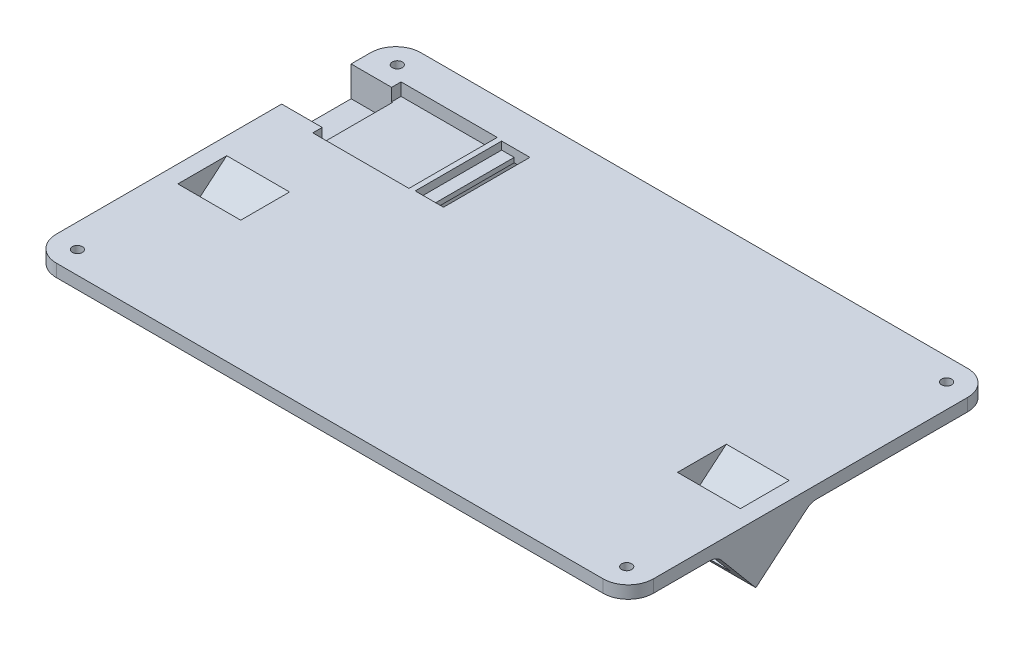
from build123d import *

# Parameters (mm, degrees)
SKETCH_1_W          = 272.533053494
SKETCH_1_H          = 136.587531522
EXTRUDE_1_DEPTH     = 4
SKETCH_2_W          = 272.533053494
SKETCH_2_H          = 136.587531522
CUT_EXTRUDE_1_DEPTH = 4
CUT_EXTRUDE_2_DEPTH = 4
CUT_EXTRUDE_3_DEPTH = 4
SKETCH_5_W          = 34
SKETCH_5_H          = 36
EXTRUDE_2_DEPTH     = 4
SKETCH_6_W          = 13.2
SKETCH_6_H          = 4
EXTRUDE_3_DEPTH     = 5.6
SKETCH_7_W          = 17.2
SKETCH_7_H          = 30.1
EXTRUDE_4_DEPTH     = 4
SKETCH_8_W          = 5
SKETCH_8_H          = 27.5
CUT_EXTRUDE_4_DEPTH = 4
SKETCH_9_W          = 27.5
SKETCH_9_H          = 2.5
CUT_EXTRUDE_5_DEPTH = 4
SKETCH_10_R         = 1.6
CUT_EXTRUDE_6_DEPTH = 10
EXTRUDE_5_DEPTH     = 190
SKETCH_13_W         = 20
SKETCH_13_H         = 10
CUT_EXTRUDE_7_DEPTH = 300
SKETCH_16_W         = 123.462838452
SKETCH_16_H         = 44.826507499
CUT_EXTRUDE_8_DEPTH = 21
FILLET_2_R          = 5


with BuildPart() as part:
    # 草图1 → 凸台-拉伸1 (new body)
    with BuildSketch(Plane(origin=(0, 0, 0), x_dir=(1, 0, 0), z_dir=(0, 1, 0))):
        Rectangle(SKETCH_1_W, SKETCH_1_H)
    extrude(amount=EXTRUDE_1_DEPTH)

    # 草图2 → 切除-拉伸1 (cut)
    with BuildSketch(Plane(origin=(0, 4, 0), x_dir=(1, 0, 0), z_dir=(0, 1, 0))):
        Rectangle(SKETCH_2_W, SKETCH_2_H)
        with BuildLine():
            Line((-87, 58), (87, 58))
            ThreePointArc((87, 58), (92.656854249, 55.656854249), (95, 50))
            Line((95, 50), (95, -50))
            ThreePointArc((95, -50), (92.656854249, -55.656854249), (87, -58))
            Line((87, -58), (-87, -58))
            ThreePointArc((-87, -58), (-92.656854249, -55.656854249), (-95, -50))
            Line((-95, -50), (-95, 50))
            ThreePointArc((-95, 50), (-92.656854249, 55.656854249), (-87, 58))
        make_face(mode=Mode.SUBTRACT)
    extrude(amount=-CUT_EXTRUDE_1_DEPTH, mode=Mode.SUBTRACT)

    # 草图3 → 切除-拉伸2 (cut)
    with BuildSketch(Plane.XZ):
        Polygon((-95, -22), (-81.8, -22), (-81.8, -19), (-51.8, -19), (-51.8, -46.5), (-81.8, -46.5), (-81.8, -43.5), (-95, -43.5), align=None)
    extrude(amount=-CUT_EXTRUDE_2_DEPTH, mode=Mode.SUBTRACT)

    # 草图4 → 切除-拉伸3 (cut)
    with BuildSketch(Plane.XZ):
        Polygon((-51.5, -18.7), (-51.5, -46.8), (-82.1, -46.8), (-82.1, -43.8), (-95, -43.8), (-95, -21.7), (-82.1, -21.7), (-82.1, -18.7), align=None)
    extrude(amount=-CUT_EXTRUDE_3_DEPTH, mode=Mode.SUBTRACT)

    # 草图5 → 凸台-拉伸2 (add)
    with BuildSketch(Plane.XZ):
        with Locations((-64.8, -32.75)):
            Rectangle(SKETCH_5_W, SKETCH_5_H)
    extrude(amount=EXTRUDE_2_DEPTH)

    # 草图6 → 凸台-拉伸3 (add)
    with BuildSketch(Plane.XZ):
        with Locations((-88.4, -19.7)):
            Rectangle(SKETCH_6_W, SKETCH_6_H)
        with Locations((-88.4, -45.8)):
            Rectangle(SKETCH_6_W, SKETCH_6_H)
    extrude(amount=EXTRUDE_3_DEPTH)

    # 草图7 → 凸台-拉伸4 (add)
    with BuildSketch(Plane.XZ.offset(5.6)):
        with Locations((-86.4, -32.75)):
            Rectangle(SKETCH_7_W, SKETCH_7_H)
    extrude(amount=EXTRUDE_4_DEPTH)

    # 草图8 → 切除-拉伸4 (cut)
    with BuildSketch(Plane(origin=(0, 4, 0), x_dir=(1, 0, 0), z_dir=(0, 1, 0))):
        with Locations((-43.3, 32.75)):
            Rectangle(SKETCH_8_W, SKETCH_8_H)
    extrude(amount=-CUT_EXTRUDE_4_DEPTH, mode=Mode.SUBTRACT)

    # 草图9 → 切除-拉伸5 (cut)
    with BuildSketch(Plane(origin=(-45.8, 0, 0), x_dir=(0, 0, -1), z_dir=(1, 0, 0))):
        with Locations((32.75, 2.75)):
            Rectangle(SKETCH_9_W, SKETCH_9_H)
    extrude(amount=-CUT_EXTRUDE_5_DEPTH, mode=Mode.SUBTRACT)

    # 草图10 → 切除-拉伸6 (cut)
    with BuildSketch(Plane(origin=(0, 4, 0), x_dir=(1, 0, 0), z_dir=(0, 1, 0))):
        with Locations(Location((87.4, 50.9, 0), (0, 0, 270))):
            Circle(SKETCH_10_R)
        with Locations(Location((-87.4, 50.9, 0), (0, 0, 270))):
            Circle(SKETCH_10_R)
        with Locations(Location((-87.4, -50.9, 0), (0, 0, 270))):
            Circle(SKETCH_10_R)
        with Locations(Location((87.4, -50.9, 0), (0, 0, 270))):
            Circle(SKETCH_10_R)
    extrude(amount=-CUT_EXTRUDE_6_DEPTH, mode=Mode.SUBTRACT)

    # 草图11 → 凸台-拉伸5 (add)
    with BuildSketch(Plane(origin=(95, 0, 0), x_dir=(0, 0, -1), z_dir=(1, 0, 0))):
        Polygon((0.198533436, 0.024346469), (-29.801466564, 0), (-17.394200934, -14.762056921), align=None)
    extrude(amount=-EXTRUDE_5_DEPTH)

    # 草图13 → 切除-拉伸7 (cut)
    with BuildSketch(Plane(origin=(0, -14.678538072, 17.464397151), x_dir=(1, 0, 0), z_dir=(0, -0.6434090803775565, 0.7655225374133063))):
        with Locations((79.5, 8.890899555)):
            Rectangle(SKETCH_13_W, SKETCH_13_H)
        with Locations((-79.5, 8.890899555)):
            Rectangle(SKETCH_13_W, SKETCH_13_H)
    extrude(amount=-CUT_EXTRUDE_7_DEPTH, mode=Mode.SUBTRACT)

    # 草图16 → 切除-拉伸8 (cut)
    with BuildSketch(Plane.XZ):
        with Locations((0, 10.193598456)):
            Rectangle(SKETCH_16_W, SKETCH_16_H)
    extrude(amount=CUT_EXTRUDE_8_DEPTH, mode=Mode.SUBTRACT)

    # 圆角2
    fillet_2_edges = [part.edges().sort_by_distance(p)[0] for p in [
        (-78.365709613, 0, 29.801466564),
        (-78.365709613, 0, -0.169566218),
        (78.365709613, 0, -0.169566218),
        (78.365709613, 0, 29.801466564),
        (61.731419226, 0, 14.815950173),
        (-61.731419226, 0, 14.815950173),
    ]]
    fillet(fillet_2_edges, radius=FILLET_2_R)


solid = part.part
